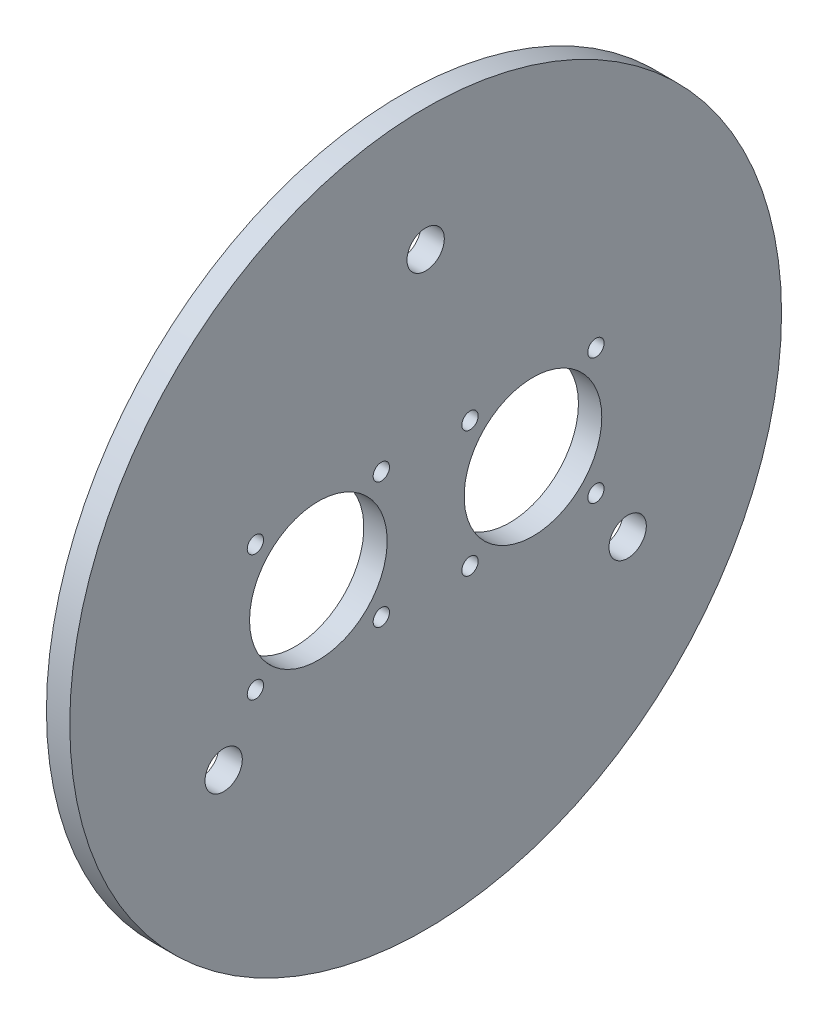
from build123d import *

# Parameters (mm, degrees)
SKETCH1_R           = 76.29
SKETCH1_R_2         = 4
SKETCH1_R_3         = 14.75
SKETCH1_R_4         = 1.75
BOSS_EXTRUDE1_DEPTH = 5


with BuildPart() as part:
    # Sketch1 → Boss-Extrude1 (new body)
    with BuildSketch(Plane(origin=(0, 0, 0), x_dir=(0, 0, -1), z_dir=(1, 0, 0))):
        Circle(SKETCH1_R)
        with Locations((0, 50)):
            Circle(SKETCH1_R_2, mode=Mode.SUBTRACT)
        with Locations((43.301270189, -25)):
            Circle(SKETCH1_R_2, mode=Mode.SUBTRACT)
        with Locations((-43.301270189, -25)):
            Circle(SKETCH1_R_2, mode=Mode.SUBTRACT)
        with Locations((23, 0)):
            Circle(SKETCH1_R_3, mode=Mode.SUBTRACT)
        with Locations(Location((-23, 0, 0), (0, 0, 180))):
            Circle(SKETCH1_R_3, mode=Mode.SUBTRACT)
        with Locations((36.496900686, 13.496900686)):
            Circle(SKETCH1_R_4, mode=Mode.SUBTRACT)
        with Locations((36.496900686, -13.496900686)):
            Circle(SKETCH1_R_4, mode=Mode.SUBTRACT)
        with Locations((9.503099314, -13.496900686)):
            Circle(SKETCH1_R_4, mode=Mode.SUBTRACT)
        with Locations((9.503099314, 13.496900686)):
            Circle(SKETCH1_R_4, mode=Mode.SUBTRACT)
        with Locations(Location((-36.496900686, -13.496900686, 0), (0, 0, 180))):
            Circle(SKETCH1_R_4, mode=Mode.SUBTRACT)
        with Locations(Location((-9.503099314, -13.496900686, 0), (0, 0, 180))):
            Circle(SKETCH1_R_4, mode=Mode.SUBTRACT)
        with Locations(Location((-9.503099314, 13.496900686, 0), (0, 0, 180))):
            Circle(SKETCH1_R_4, mode=Mode.SUBTRACT)
        with Locations(Location((-36.496900686, 13.496900686, 0), (0, 0, 180))):
            Circle(SKETCH1_R_4, mode=Mode.SUBTRACT)
    extrude(amount=BOSS_EXTRUDE1_DEPTH)


solid = part.part
